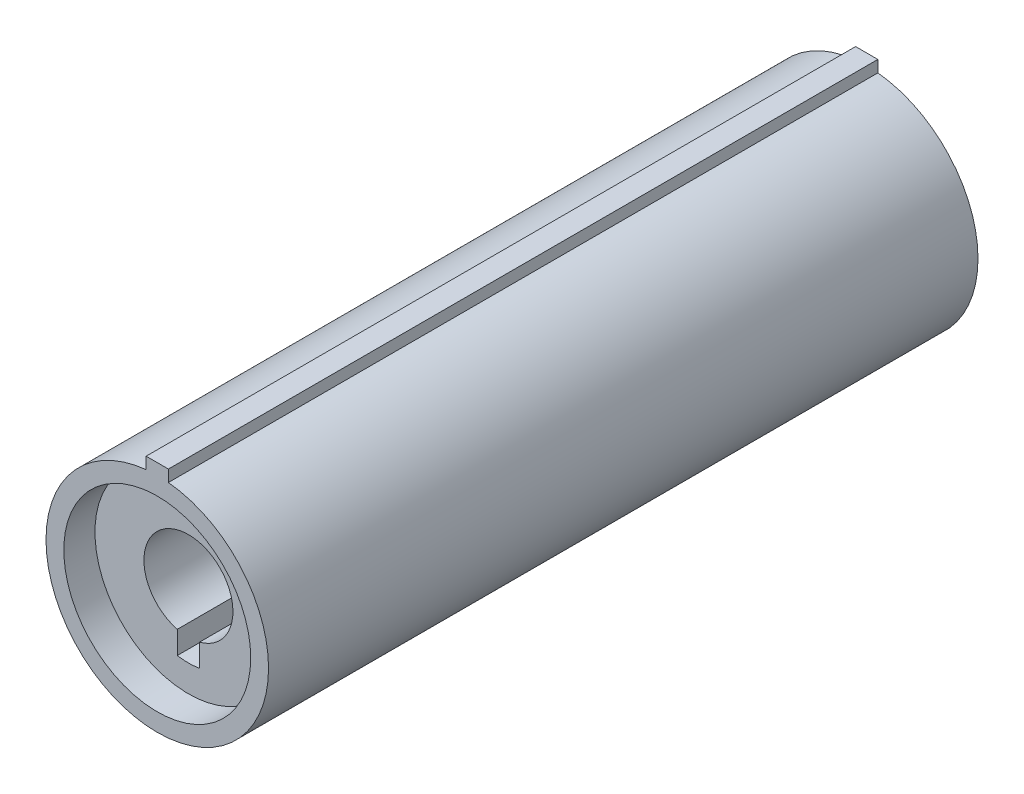
from build123d import *

# Parameters (mm, degrees)
BOSS_EXTRUDE1_DEPTH = 152.4
SKETCH3_R           = 21
BOSS_EXTRUDE2_DEPTH = 7
BOSS_EXTRUDE3_START = -152.4
BOSS_EXTRUDE3_DEPTH = 152.4


with BuildPart() as part:
    # Sketch1 → Boss-Extrude1 (new body)
    with BuildSketch(Plane.XY):
        with BuildLine():
            Line((-2.5, 27.5), (-2.5, 24.874685928))
            ThreePointArc((-2.5, 24.874685928), (-25, 0), (-2.5, -24.874685928))
            Line((-2.5, -24.874685928), (-2.5, -9.682458366))
            ThreePointArc((-2.5, -9.682458366), (0, 10), (2.5, -9.682458366))
            Line((2.5, -9.682458366), (2.5, -24.874685928))
            ThreePointArc((2.5, -24.874685928), (25, 0), (2.5, 24.874685928))
            Line((2.5, 24.874685928), (2.5, 27.5))
            Line((2.5, 27.5), (-2.5, 27.5))
        make_face()
    extrude(amount=BOSS_EXTRUDE1_DEPTH)

    # Sketch3 → Boss-Extrude2 (add)
    with BuildSketch(Plane.XY.offset(152.4)):
        with BuildLine():
            Line((-2.5, 27.5), (2.5, 27.5))
            Line((2.5, 27.5), (2.5, 24.874685928))
            ThreePointArc((2.5, 24.874685928), (24.874685928, -2.5), (-2.5, -24.874685928))
            ThreePointArc((-2.5, -24.874685928), (-25, 0), (-2.5, 24.874685928))
            Line((-2.5, 24.874685928), (-2.5, 27.5))
        make_face()
        with Locations(Location((0, 0, 0), (0, 0, 263.162858832))):
            Circle(SKETCH3_R, mode=Mode.SUBTRACT)
    extrude(amount=BOSS_EXTRUDE2_DEPTH)

    # Sketch4 → Boss-Extrude3 (add)
    with BuildSketch(Plane.XY.offset(152.4).offset(BOSS_EXTRUDE3_START)):
        with BuildLine():
            Line((-2.5, -14.790199458), (-2.5, -24.874685928))
            ThreePointArc((-2.5, -24.874685928), (0, -25), (2.5, -24.874685928))
            Line((2.5, -24.874685928), (2.5, -14.790199458))
            ThreePointArc((2.5, -14.790199458), (0, -15), (-2.5, -14.790199458))
        make_face()
    extrude(amount=BOSS_EXTRUDE3_DEPTH)


solid = part.part
